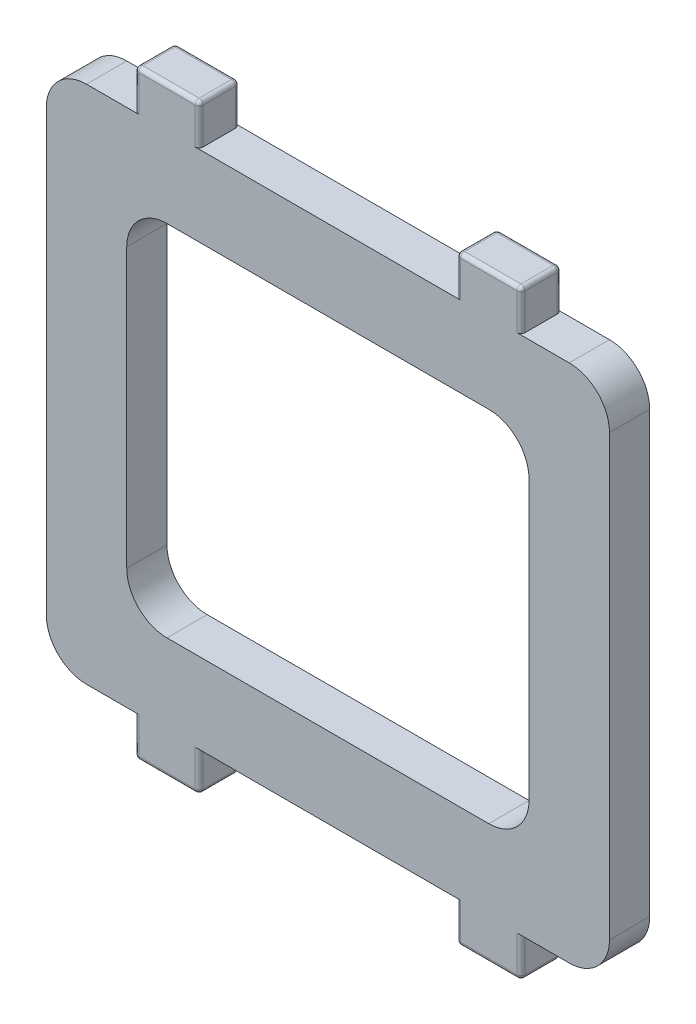
from build123d import *

# Parameters (mm, degrees)
CROQUIS1_W               = 70
CROQUIS1_H               = 64.6
CROQUIS1_W_2             = 50
CROQUIS1_H_2             = 44.6
SALIENTE_EXTRUIR1_DEPTH  = 5
CROQUIS2_W               = 8
CROQUIS2_H               = 5
SALIENTE_EXTRUIR2_DEPTH  = 5
REDONDEO1_R              = 0.5
REDONDEO1_OF_SIMETR_A1_R = 0.5
REDONDEO2_R              = 5


with BuildPart() as part:
    # Croquis1 → Saliente-Extruir1 (new body)
    with BuildSketch(Plane.XY):
        Rectangle(CROQUIS1_W, CROQUIS1_H)
        Rectangle(CROQUIS1_W_2, CROQUIS1_H_2, mode=Mode.SUBTRACT)
    extrude(amount=SALIENTE_EXTRUIR1_DEPTH)

    # Croquis2 → Saliente-Extruir2 (add)
    with BuildSketch(Plane.XZ.offset(32.3)):
        with Locations((-20, 2.5)):
            Rectangle(CROQUIS2_W, CROQUIS2_H)
        with Locations((20, 2.5)):
            Rectangle(CROQUIS2_W, CROQUIS2_H)
    saliente_extruir2 = extrude(amount=SALIENTE_EXTRUIR2_DEPTH)

    # Redondeo1
    redondeo1_edges = [part.edges().sort_by_distance(p)[0] for p in [
        (-24, -34.8, 5),
        (-24, -34.8, 0),
        (-16, -34.8, 0),
        (-16, -34.8, 5),
        (-24, -37.3, 2.5),
        (-20, -37.3, 0),
        (-16, -37.3, 2.5),
        (-20, -37.3, 5),
        (16, -34.8, 0),
        (24, -34.8, 0),
        (24, -34.8, 5),
        (16, -34.8, 5),
        (20, -37.3, 0),
        (24, -37.3, 2.5),
        (20, -37.3, 5),
        (16, -37.3, 2.5),
    ]]
    fillet(redondeo1_edges, radius=REDONDEO1_R)

    # Simetría1: Saliente-Extruir2 across plane
    add(saliente_extruir2.mirror(Plane.ZX))

    # Redondeo1 of Simetría1
    redondeo1_of_simetr_a1_edges = [part.edges().sort_by_distance(p)[0] for p in [
        (-24, 34.8, 5),
        (-24, 34.8, 0),
        (-16, 34.8, 0),
        (-16, 34.8, 5),
        (-24, 37.3, 2.5),
        (-20, 37.3, 0),
        (-16, 37.3, 2.5),
        (-20, 37.3, 5),
        (16, 34.8, 0),
        (24, 34.8, 0),
        (24, 34.8, 5),
        (16, 34.8, 5),
        (20, 37.3, 0),
        (24, 37.3, 2.5),
        (20, 37.3, 5),
        (16, 37.3, 2.5),
    ]]
    fillet(redondeo1_of_simetr_a1_edges, radius=REDONDEO1_OF_SIMETR_A1_R)

    # Redondeo2
    redondeo2_edges = [part.edges().sort_by_distance(p)[0] for p in [
        (-25, 22.3, 2.5),
        (-25, -22.3, 2.5),
        (25, -22.3, 2.5),
        (25, 22.3, 2.5),
        (-35, 32.3, 2.5),
        (35, 32.3, 2.5),
        (35, -32.3, 2.5),
        (-35, -32.3, 2.5),
    ]]
    fillet(redondeo2_edges, radius=REDONDEO2_R)


solid = part.part
